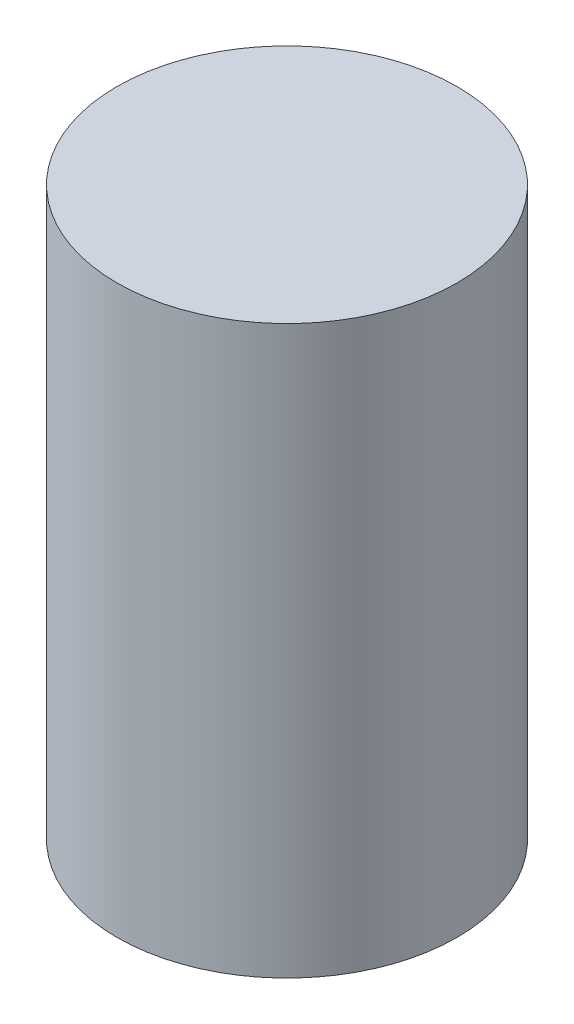
from build123d import *

# Parameters (mm, degrees)
SKETCH_1_R      = 1.5
EXTRUDE_1_DEPTH = 5


with BuildPart() as part:
    # 草图1 → 凸台-拉伸1 (new body)
    with BuildSketch(Plane(origin=(0, 0, 0), x_dir=(1, 0, 0), z_dir=(0, 1, 0))):
        with Locations(Location((0, 0, 0), (0, 0, 270))):
            Circle(SKETCH_1_R)
    extrude(amount=EXTRUDE_1_DEPTH)


solid = part.part
